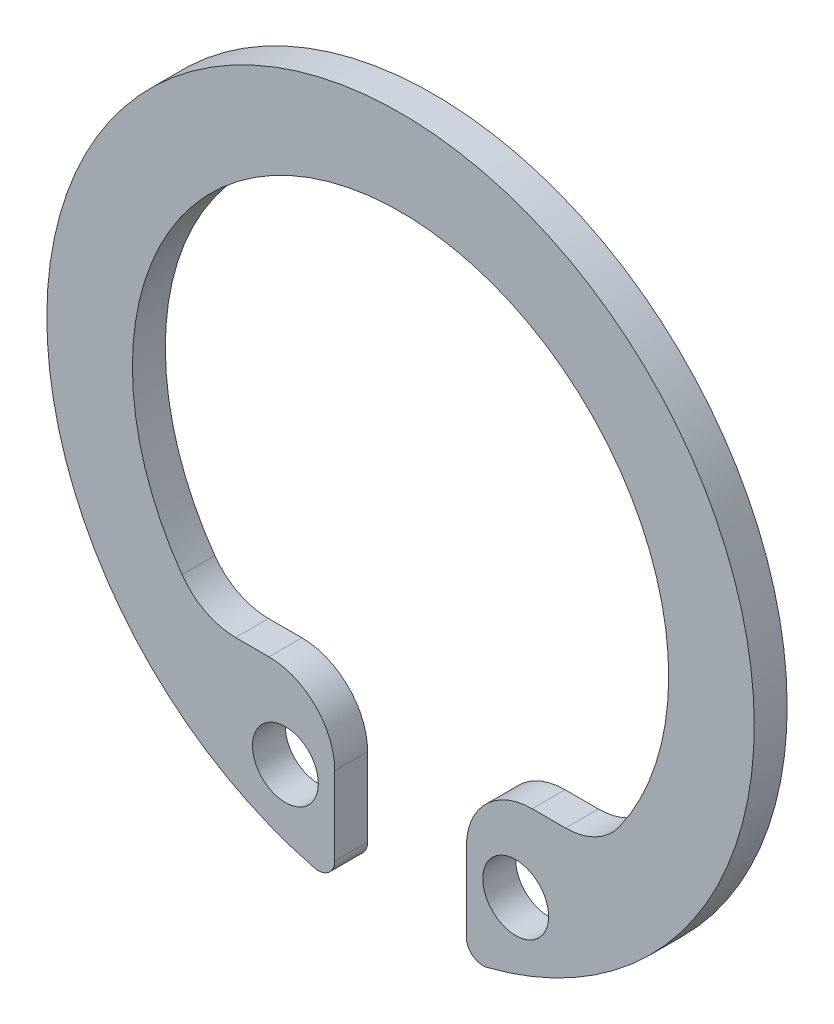
from build123d import *

# Parameters (mm, degrees)
IZIM1_R                     = 1
Y_KSEKLIK_EKSTR_ZYON1_DEPTH = 1
RADYUS1_R                   = 2
RADYUS2_R                   = 0.5


with BuildPart() as part:
    # Çizim1 → Yükseklik-Ekstrüzyon1 (new body)
    with BuildSketch(Plane.XY):
        with BuildLine():
            Line((-2, -5.562315087), (-2, -10.562315087))
            ThreePointArc((-2, -10.562315087), (0, 10.75), (2, -10.562315087))
            Line((2, -10.562315087), (2, -5.562315087))
            Line((2, -5.562315087), (5.956773529, -5.562315087))
            ThreePointArc((5.956773529, -5.562315087), (0, 8.15), (-5.956773529, -5.562315087))
            Line((-5.956773529, -5.562315087), (-2, -5.562315087))
        make_face()
        with Locations((-3.5, -8.15)):
            Circle(IZIM1_R, mode=Mode.SUBTRACT)
        with Locations((3.5, -8.15)):
            Circle(IZIM1_R, mode=Mode.SUBTRACT)
    extrude(amount=Y_KSEKLIK_EKSTR_ZYON1_DEPTH)

    # Radyus1
    radyus1_edges = [part.edges().sort_by_distance(p)[0] for p in [
        (-2, -5.562315087, 0.5),
        (2, -5.562315087, 0.5),
        (5.956773529, -5.562315087, 0.5),
        (-5.956773529, -5.562315087, 0.5),
    ]]
    fillet(radyus1_edges, radius=RADYUS1_R)

    # Radyus2
    radyus2_edges = [part.edges().sort_by_distance(p)[0] for p in [
        (-2, -10.562315087, 0.5),
        (2, -10.562315087, 0.5),
    ]]
    fillet(radyus2_edges, radius=RADYUS2_R)


solid = part.part
